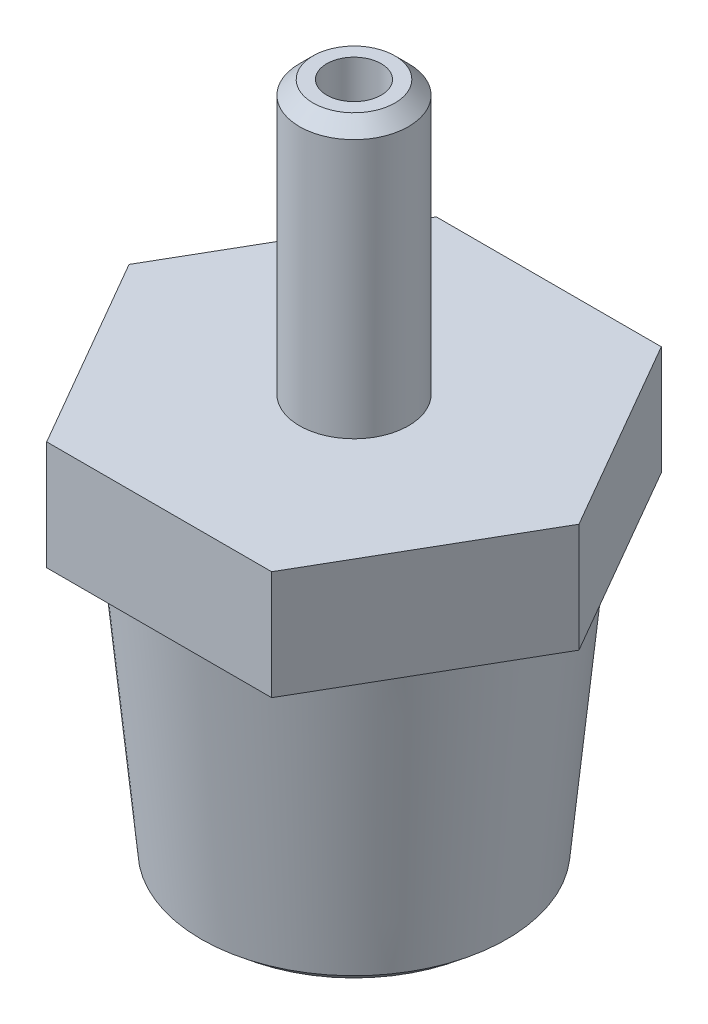
from build123d import *
from OCP.BRepFilletAPI import BRepFilletAPI_MakeChamfer

# Parameters (mm, degrees)
SKETCH2_R           = 1
BOSS_EXTRUDE1_DEPTH = 4
CHAMFER1_SIZE       = 0.5
CHAMFER1_SIZE2      = 0.555807111


with BuildPart() as part:
    # Sketch1 → Revolve1 (revolve)
    with BuildSketch(Plane.XY, mode=Mode.PRIVATE) as revolve1_sk:
        Polygon((1, 25), (2, 25), (2, 15), (7, 15), (5.55625, 0), (3.55625, 0), (3.55625, 12), (1, 12), align=None)
    revolve(revolve1_sk.sketch.rotate(Axis((0, 0, 0), (0, 1, 0)), 90), axis=Axis((0, 0, 0), (0, 1, 0)))

    # Sketch2 → Boss-Extrude1 (add)
    with BuildSketch(Plane(origin=(0, 15, 0), x_dir=(1, 0, 0), z_dir=(0, 1, 0))):
        Polygon((-8.248891971, 0), (-4.124445986, -7.14375), (4.124445986, -7.14375), (8.248891971, 0), (4.124445986, 7.14375), (-4.124445986, 7.14375), align=None)
        with Locations(Location((0, 0, 0), (0, 0, 90))):
            Circle(SKETCH2_R, mode=Mode.SUBTRACT)
    extrude(amount=-BOSS_EXTRUDE1_DEPTH)

    # Chamfer1: one chamfer whose edges measure the first distance from different faces: ONE call of the kernel's chamfer builder (chamfer() names one face for all edges)
    chamfer1_edges_1 = [part.edges().sort_by_distance(p)[0] for p in [
        (0, 0, 5.55625),
    ]]
    chamfer1_side_1 = [part.faces().sort_by_distance(p)[0] for p in [
        (0, 5.5, 6.085625),
    ]]
    chamfer1_edges_2 = [part.edges().sort_by_distance(p)[0] for p in [
        (0, 25, 2),
    ]]
    chamfer1 = BRepFilletAPI_MakeChamfer(part.part.solid().wrapped)
    for e in chamfer1_edges_1:
        chamfer1.Add(CHAMFER1_SIZE, CHAMFER1_SIZE2, e.wrapped, chamfer1_side_1[0].wrapped)  # the first distance lies on this face
    for e in chamfer1_edges_2:
        chamfer1.Add(CHAMFER1_SIZE, e.wrapped)
    add(Compound.cast(chamfer1.Shape()), mode=Mode.REPLACE)


solid = part.part
